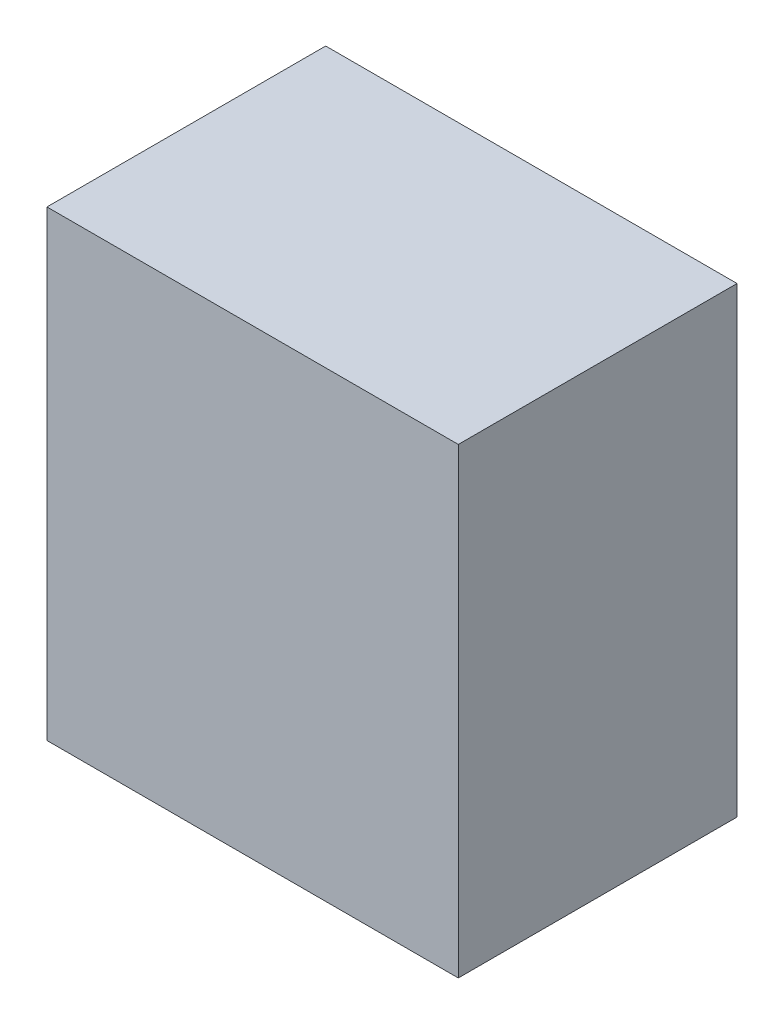
from build123d import *

# Parameters (mm, degrees)
SKETCH_1_W         = 6.08
SKETCH_1_H         = 6.83
EXTRUDE_1_DEPTH    = 4.12
SKETCH_2_R         = 2.35
EXTRUDE_2_DEPTH    = 0.1
DOME_1_FACE_RADIUS = 2.35
DOME_1_HEIGHT      = 1.45


with BuildPart() as part:
    # 草图1 → 拉伸1 (new body)
    with BuildSketch(Plane.XY):
        Rectangle(SKETCH_1_W, SKETCH_1_H)
    extrude(amount=EXTRUDE_1_DEPTH)

    # 草图2 → 拉伸2 (add)
    with BuildSketch(Plane(origin=(0, 0, 0), x_dir=(-1, 0, 0), z_dir=(0, 0, -1))):
        with Locations(Location((0, 0.565, 0), (0, 0, 180))):
            Circle(SKETCH_2_R)
    extrude(amount=EXTRUDE_2_DEPTH)

    # 圆顶1: a dome of height H over a round flat face of radius A is a cap of a sphere of radius (A * A + H * H) / (2 * H)
    dome_1_r = (DOME_1_FACE_RADIUS * DOME_1_FACE_RADIUS + DOME_1_HEIGHT * DOME_1_HEIGHT) / (2 * DOME_1_HEIGHT)
    dome_1_base = Plane((0, 0.565, -0.1), z_dir=(0, 0, -1))
    with Locations(dome_1_base.offset(DOME_1_HEIGHT - dome_1_r)):
        dome_1_ball = Sphere(dome_1_r, mode=Mode.PRIVATE)
    add(split(dome_1_ball, bisect_by=dome_1_base, keep=Keep.TOP, mode=Mode.PRIVATE))


solid = part.part
